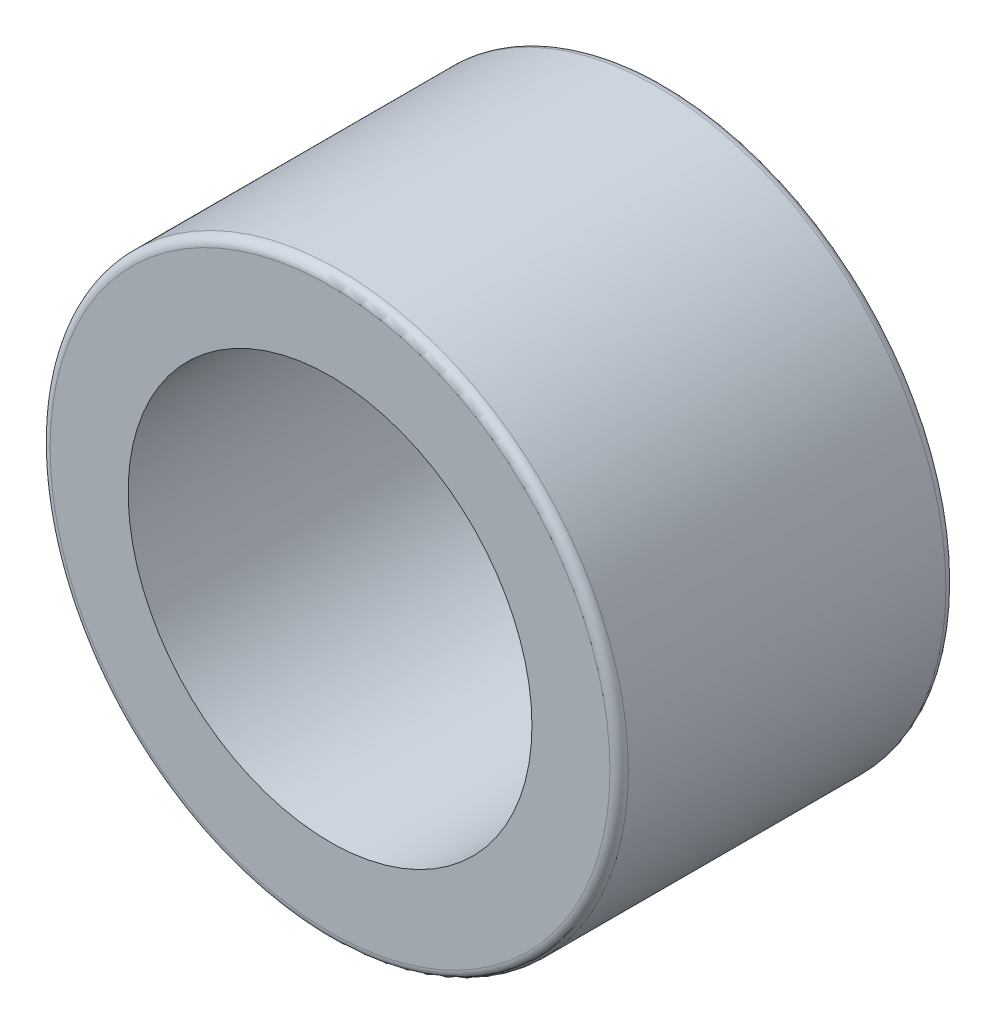
from build123d import *

# Parameters (mm, degrees)
ESQUISSE1_R        = 31.5
ESQUISSE1_R_2      = 22
BOSS_EXTRU_1_DEPTH = 36.6
CONG_1_R           = 1


with BuildPart() as part:
    # Esquisse1 → Boss.-Extru.1 (new body)
    with BuildSketch(Plane.XY):
        Circle(ESQUISSE1_R)
        Circle(ESQUISSE1_R_2, mode=Mode.SUBTRACT)
    extrude(amount=BOSS_EXTRU_1_DEPTH)

    # Congé1
    cong_1_edges = [part.edges().sort_by_distance(p)[0] for p in [
        (-31.5, 0, 0),
        (-31.5, 0, 36.6),
    ]]
    fillet(cong_1_edges, radius=CONG_1_R)


solid = part.part
